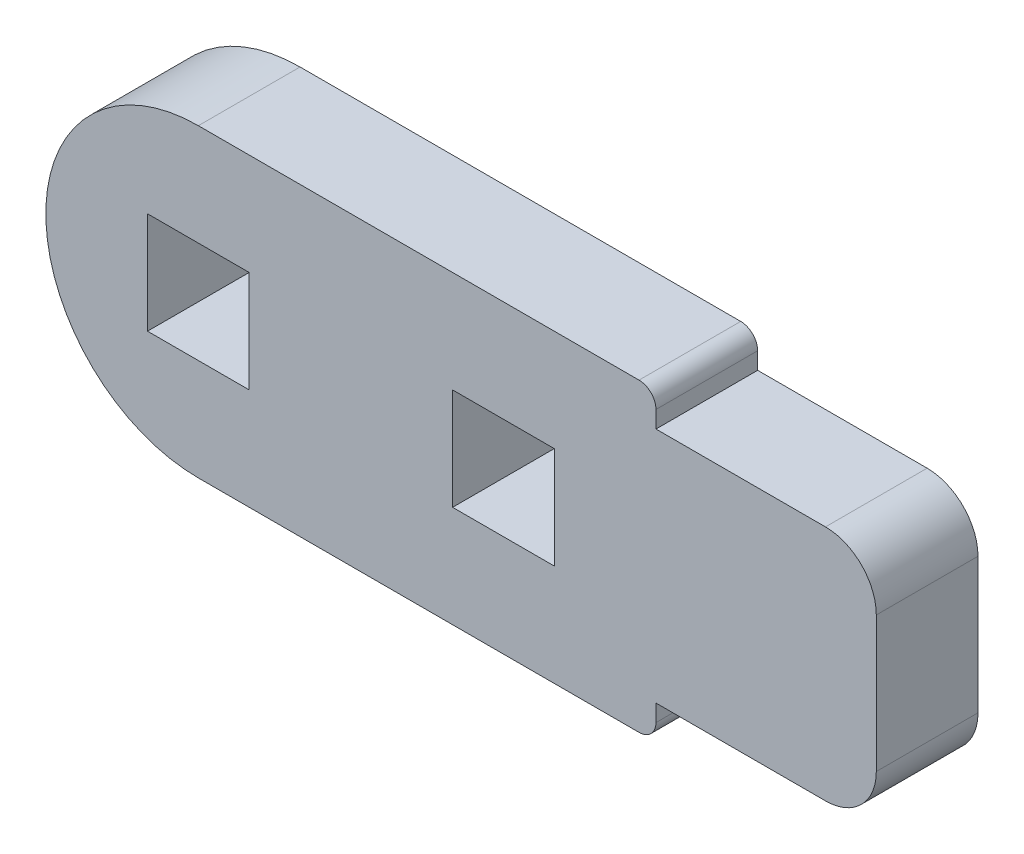
from build123d import *

# Parameters (mm, degrees)
MODEL_W                 = 3
MODEL_H                 = 3
SALIENTE_EXTRUIR2_DEPTH = 3


with BuildPart() as part:
    # Model → Saliente-Extruir2 (new body)
    with BuildSketch(Plane.XY):
        with BuildLine():
            Line((25.281533596, 296.606231861), (12.281533596, 296.606231861))
            ThreePointArc((12.281533596, 296.606231861), (7.781533596, 292.106231861), (12.281533596, 287.606231861))
            Line((12.281533596, 287.606231861), (25.281533596, 287.606231861))
            ThreePointArc((25.281533596, 287.606231861), (25.635086987, 287.752678471), (25.781533596, 288.106231861))
            Line((25.781533596, 288.106231861), (25.781533596, 288.606231861))
            Line((25.781533596, 288.606231861), (30.781533596, 288.606231861))
            ThreePointArc((30.781533596, 288.606231861), (31.842193768, 289.045571689), (32.281533596, 290.106231861))
            Line((32.281533596, 290.106231861), (32.281533596, 294.106231861))
            ThreePointArc((32.281533596, 294.106231861), (31.842193768, 295.166892033), (30.781533596, 295.606231861))
            Line((30.781533596, 295.606231861), (25.781533596, 295.606231861))
            Line((25.781533596, 295.606231861), (25.781533596, 296.106231861))
            ThreePointArc((25.781533596, 296.106231861), (25.635086987, 296.459785252), (25.281533596, 296.606231861))
        make_face()
        with Locations((12.281533596, 292.106231861)):
            Rectangle(MODEL_W, MODEL_H, mode=Mode.SUBTRACT)
        with Locations((21.281533596, 292.106231861)):
            Rectangle(MODEL_W, MODEL_H, mode=Mode.SUBTRACT)
    extrude(amount=SALIENTE_EXTRUIR2_DEPTH)


solid = part.part
